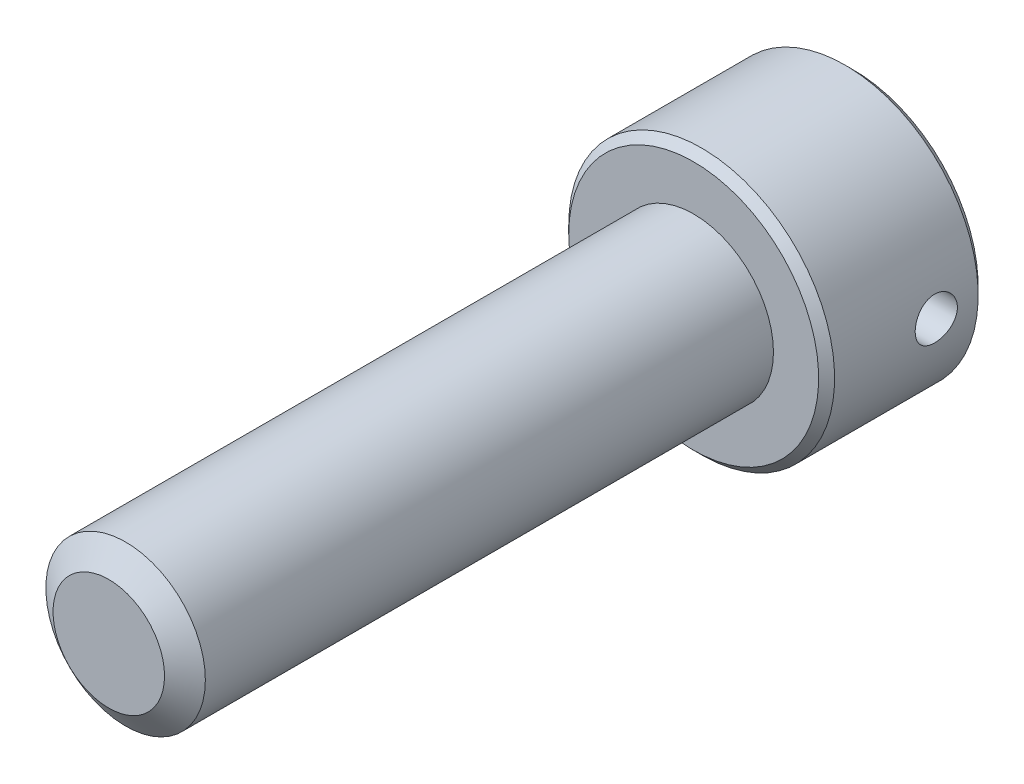
from build123d import *

# Parameters (mm, degrees)
SKETCH1_R               = 3
EXTRUDE1_DEPTH          = 22
SKETCH6_R               = 5
EXTRUDE2_DEPTH          = 6
CUT_EXTRUDE1_DEPTH      = 3.75
CHAMFER1_SIZE           = 0.3
CUT_EXTRUDE4_DEPTH      = 29.879058156
CUT_EXTRUDE4_DEPTH_BACK = 29.879058156
SKETCH13_R              = 0.79375


with BuildPart() as part:
    # Sketch1 → Extrude1 (new body)
    with BuildSketch(Plane.XY):
        Circle(SKETCH1_R)
    extrude(amount=-EXTRUDE1_DEPTH)

    # Sketch4 → Cut-Revolve1 (revolve, cut)
    with BuildSketch(Plane(origin=(0, 0, 0), x_dir=(0, 0, -1), z_dir=(1, 0, 0))):
        Polygon((0.632650852, 3), (0, 2.096480947), (0, 3), align=None)
    revolve(axis=Axis((0, 0, 0), (0, 0, -1)), mode=Mode.SUBTRACT)

    # Sketch6 → Extrude2 (add)
    with BuildSketch(Plane(origin=(0, 0, -22), x_dir=(-1, 0, 0), z_dir=(0, 0, -1))):
        Circle(SKETCH6_R)
    extrude(amount=EXTRUDE2_DEPTH)

    # Sketch7 → Cut-Extrude1 (cut)
    with BuildSketch(Plane(origin=(0, 0, -28), x_dir=(-1, 0, 0), z_dir=(0, 0, -1))):
        Polygon((0, 2.886751346), (-2.5, 1.443375673), (-2.5, -1.443375673), (0, -2.886751346), (2.5, -1.443375673), (2.5, 1.443375673), align=None)
    extrude(amount=-CUT_EXTRUDE1_DEPTH, mode=Mode.SUBTRACT)

    # Cut-Extrude2 cone 1 section (through the dimple's axis) → Cut-Extrude2 (revolve, cut)
    with BuildSketch(Plane(origin=(0, 0, -28), x_dir=(0, 1, 0), z_dir=(1, 0, 0))):
        Polygon((0, 0), (2.886751346, 0), (0, 2.886751346), align=None)
    revolve(axis=Axis((0, 0, -28), (0, 0, 1)), mode=Mode.SUBTRACT)

    # Chamfer1
    chamfer1_edges = [part.edges().sort_by_distance(p)[0] for p in [
        (5, 0, -28),
        (5, 0, -22),
    ]]
    chamfer(chamfer1_edges, length=CHAMFER1_SIZE)

    # Sketch10 → Revolve1 (revolve)
    with BuildSketch(Plane(origin=(0, 0, 0), x_dir=(0, 0, -1), z_dir=(1, 0, 0))):
        Polygon((22, 3), (22, 0), (20.507359313, 0), (21.75, 3), align=None)
    revolve(axis=Axis((0, 0, -22), (0, 0, 1)))

    # Sketch13 → Cut-Extrude4 (cut, two sides: drawn at the far end of the back side and taken through both)
    with BuildSketch(Plane(origin=(0, 0, 0), x_dir=(0, 0, -1), z_dir=(1, 0, 0)).offset(-CUT_EXTRUDE4_DEPTH_BACK)):
        with Locations((26.125, 0)):
            Circle(SKETCH13_R)
    extrude(amount=CUT_EXTRUDE4_DEPTH + CUT_EXTRUDE4_DEPTH_BACK, mode=Mode.SUBTRACT)


solid = part.part
